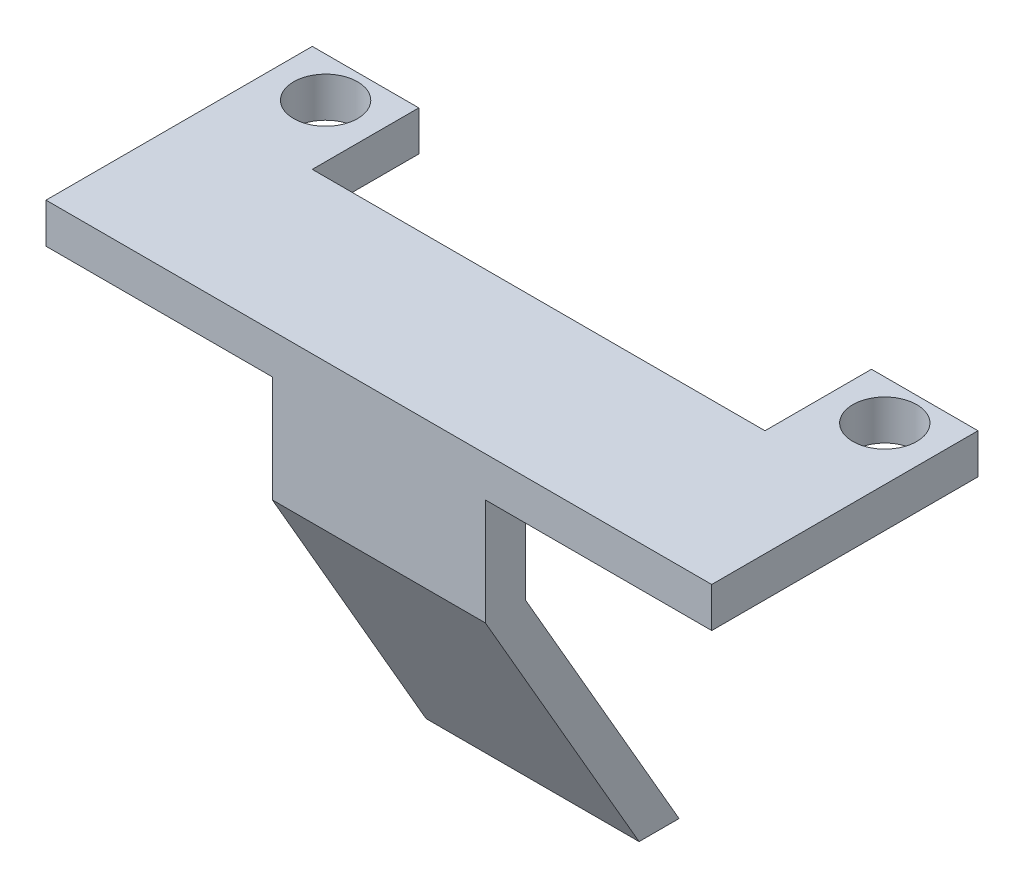
from build123d import *

# Parameters (mm, degrees)
SKETCH1_R           = 1.2
BOSS_EXTRUDE1_DEPTH = 1.5
SKETCH2_W           = 8
SKETCH2_H           = 1.5
BOSS_EXTRUDE2_DEPTH = 4
BOSS_EXTRUDE3_DEPTH = 8


with BuildPart() as part:
    # Sketch1 → Boss-Extrude1 (new body)
    with BuildSketch(Plane(origin=(0, 0, 0), x_dir=(1, 0, 0), z_dir=(0, 1, 0))):
        Polygon((-8.5, 0), (-8.5, -4), (8.5, -4), (8.5, 0), (12.5, 0), (12.5, -10), (-12.5, -10), (-12.5, 0), align=None)
        with Locations(Location((-10.5, -1.5, 0), (0, 0, 270))):
            Circle(SKETCH1_R, mode=Mode.SUBTRACT)
        with Locations(Location((10.5, -1.5, 0), (0, 0, 270))):
            Circle(SKETCH1_R, mode=Mode.SUBTRACT)
    extrude(amount=BOSS_EXTRUDE1_DEPTH)

    # Sketch2 → Boss-Extrude2 (add)
    with BuildSketch(Plane.XZ):
        with Locations((0, 9.25)):
            Rectangle(SKETCH2_W, SKETCH2_H)
    extrude(amount=BOSS_EXTRUDE2_DEPTH)

    # Sketch3 → Boss-Extrude3 (add)
    with BuildSketch(Plane.ZY.offset(4)):
        Polygon((10, -4), (4.226497308, -14), (2.726497308, -14), (8.5, -4), align=None)
    extrude(amount=-BOSS_EXTRUDE3_DEPTH)


solid = part.part
